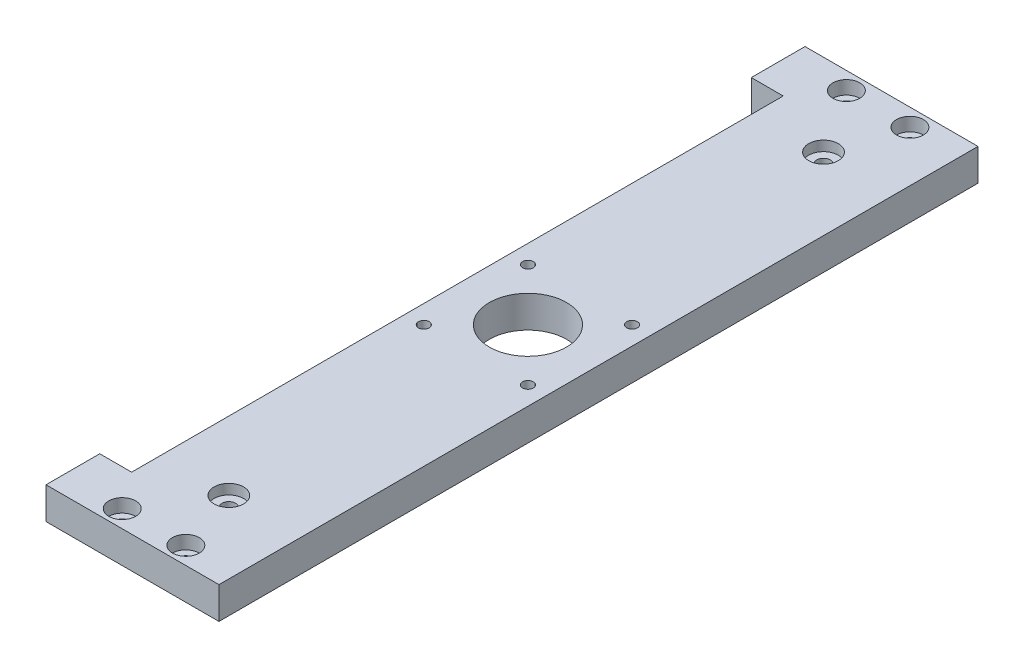
from build123d import *

# Parameters (mm, degrees)
SKETCH_1_W          = 42
SKETCH_1_H          = 226
EXTRUDE_1_DEPTH     = 9.5
SKETCH_2_R          = 11.5
CUT_EXTRUDE_1_DEPTH = 231.065751471
SKETCH_3_W          = 16
SKETCH_3_H          = 9.5
EXTRUDE_2_DEPTH     = 9.5
SKETCH_4_R          = 4.4
CUT_EXTRUDE_2_DEPTH = 3
SKETCH_5_R          = 1.6
CUT_EXTRUDE_3_DEPTH = 231.065751471
SKETCH_6_R          = 2
CUT_EXTRUDE_6_DEPTH = 231.065751471
SKETCH_7_R          = 1.9
CUT_EXTRUDE_7_DEPTH = 231.065751471
SKETCH_9_R          = 4
CUT_EXTRUDE_8_DEPTH = 4


with BuildPart() as part:
    # 草图1 → 凸台-拉伸1 (new body)
    with BuildSketch(Plane(origin=(0, 0, 0), x_dir=(1, 0, 0), z_dir=(0, 1, 0))):
        with Locations((21, -113)):
            Rectangle(SKETCH_1_W, SKETCH_1_H)
    extrude(amount=EXTRUDE_1_DEPTH)

    # 草图2 → 切除-拉伸1 (cut, through all)
    with BuildSketch(Plane(origin=(0, 9.5, 0), x_dir=(1, 0, 0), z_dir=(0, 1, 0))):
        with Locations(Location((21, -113, 0), (0, 0, 270))):
            Circle(SKETCH_2_R)
    extrude(amount=-CUT_EXTRUDE_1_DEPTH, mode=Mode.SUBTRACT)

    # 草图3 → 凸台-拉伸2 (add)
    with BuildSketch(Plane.ZY):
        with Locations((8, 4.75)):
            Rectangle(SKETCH_3_W, SKETCH_3_H)
        with Locations((218, 4.75)):
            Rectangle(SKETCH_3_W, SKETCH_3_H)
    extrude(amount=EXTRUDE_2_DEPTH)

    # 草图4 → 切除-拉伸2 (cut)
    with BuildSketch(Plane(origin=(0, 9.5, 0), x_dir=(1, 0, 0), z_dir=(0, 1, 0))):
        with Locations(Location((20.47, -201.526194604, 0), (0, 0, 270))):
            Circle(SKETCH_4_R)
        with Locations(Location((20.47, -24.473805396, 0), (0, 0, 270))):
            Circle(SKETCH_4_R)
    extrude(amount=-CUT_EXTRUDE_2_DEPTH, mode=Mode.SUBTRACT)

    # 草图5 → 切除-拉伸3 (cut, through all)
    with BuildSketch(Plane.XZ):
        with Locations(Location((5.5, 97.5, 0), (0, 0, 270))):
            Circle(SKETCH_5_R)
        with Locations(Location((5.5, 128.5, 0), (0, 0, 270))):
            Circle(SKETCH_5_R)
        with Locations(Location((36.5, 97.5, 0), (0, 0, 270))):
            Circle(SKETCH_5_R)
        with Locations(Location((36.5, 128.5, 0), (0, 0, 270))):
            Circle(SKETCH_5_R)
    extrude(amount=-CUT_EXTRUDE_3_DEPTH, mode=Mode.SUBTRACT)

    # 草图6 → 切除-拉伸6 (cut, through all)
    with BuildSketch(Plane(origin=(0, 9.5, 0), x_dir=(1, 0, 0), z_dir=(0, 1, 0))):
        with Locations(Location((20.47, -201.526194604, 0), (0, 0, 270))):
            Circle(SKETCH_6_R)
        with Locations(Location((20.47, -24.473805396, 0), (0, 0, 270))):
            Circle(SKETCH_6_R)
    extrude(amount=-CUT_EXTRUDE_6_DEPTH, mode=Mode.SUBTRACT)

    # 草图7 → 切除-拉伸7 (cut, through all)
    with BuildSketch(Plane(origin=(0, 9.5, 0), x_dir=(1, 0, 0), z_dir=(0, 1, 0))):
        with Locations(Location((8, -220.8, 0), (0, 0, 270))):
            Circle(SKETCH_7_R)
        with Locations(Location((26.938917342, -220.8, 0), (0, 0, 270))):
            Circle(SKETCH_7_R)
    cut_extrude_7 = extrude(amount=-CUT_EXTRUDE_7_DEPTH, mode=Mode.SUBTRACT)

    # 草图9 → 切除-拉伸8 (cut)
    with BuildSketch(Plane(origin=(0, 9.5, 0), x_dir=(1, 0, 0), z_dir=(0, 1, 0))):
        with Locations(Location((8, -220.8, 0), (0, 0, 270))):
            Circle(SKETCH_9_R)
        with Locations(Location((26.938917342, -220.8, 0), (0, 0, 270))):
            Circle(SKETCH_9_R)
    cut_extrude_8 = extrude(amount=-CUT_EXTRUDE_8_DEPTH, mode=Mode.SUBTRACT)

    # 镜向1: 切除-拉伸7, 切除-拉伸8 across plane
    add(cut_extrude_7.mirror(Plane.XY.offset(113)), mode=Mode.SUBTRACT)
    add(cut_extrude_8.mirror(Plane.XY.offset(113)), mode=Mode.SUBTRACT)


solid = part.part
